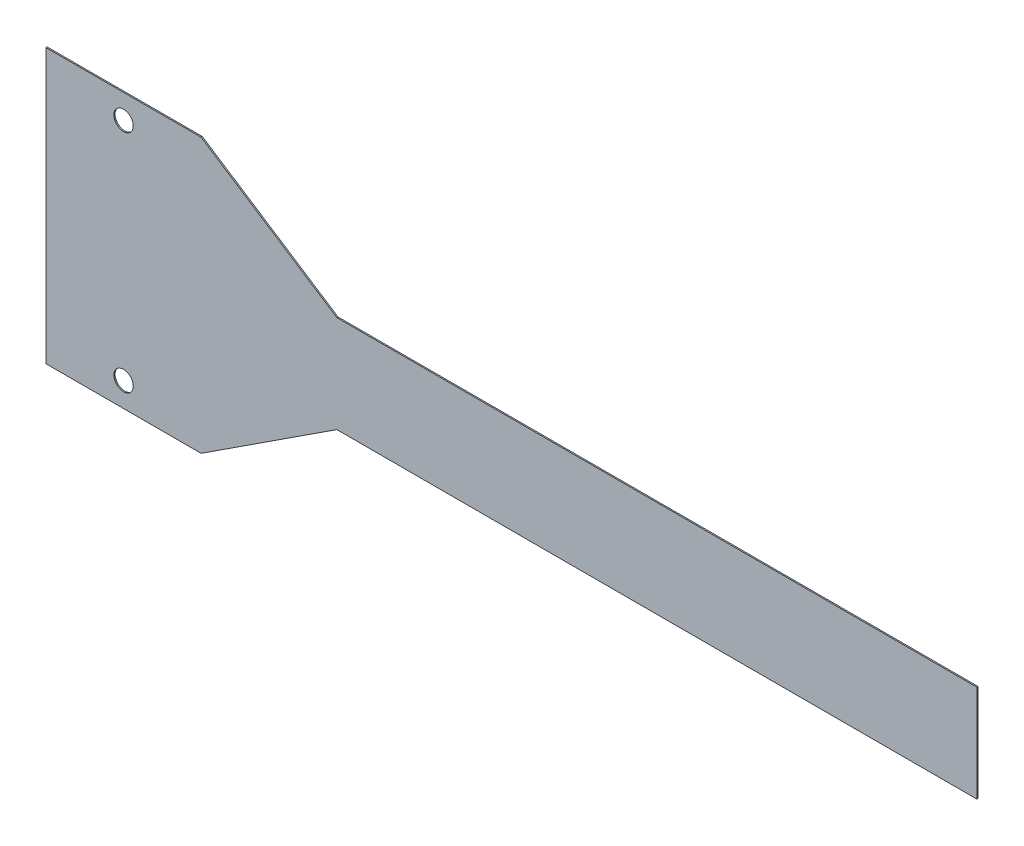
from build123d import *

# Parameters (mm, degrees)
SKETCH1_R             = 1
BOSS_EXTRUDE1_DEPTH   = 0.125
BOSS_EXTRUDE2_DEPTH   = 0.02
BOSS_EXTRUDE2_2_DEPTH = 0.02
BOSS_EXTRUDE2_3_DEPTH = 0.02


with BuildPart() as part:
    # Sketch1 → Boss-Extrude1 (new body)
    with BuildSketch(Plane.XY):
        Polygon((0, -9.12), (16, -9.12), (30, 0), (96, 0), (96, 10), (30, 10), (16, 19.12), (0, 19.12), align=None)
        with Locations((8, -6.62)):
            Circle(SKETCH1_R, mode=Mode.SUBTRACT)
        with Locations((8, 16.62)):
            Circle(SKETCH1_R, mode=Mode.SUBTRACT)
    extrude(amount=BOSS_EXTRUDE1_DEPTH)


with BuildPart() as body_2:
    # Sketch2 → Boss-Extrude2 (new body)
    with BuildSketch(Plane.XY):
        Polygon((5, -4.12), (5, -1.12), (11, -1.12), (11, -2.12), (30, 1.5), (86, 1.5), (86, 4.5), (86, 5.5), (87, 5.5), (93, 5.5), (93, 4.5), (87, 4.5), (87, 1.5), (87, 0.5), (86, 0.5), (30, 0.5), (11, -3.12), (11, -4.12), align=None)
    extrude(amount=-BOSS_EXTRUDE2_DEPTH)


with BuildPart() as body_3:
    # Sketch2 → Boss-Extrude2 2 (new body)
    with BuildSketch(Plane.XY):
        Polygon((5, 0.96), (5, 3.96), (11, 3.96), (11, 2.96), (30, 3.5), (68.5, 3.5), (68.5, 4.5), (68.5, 5.5), (69.5, 5.5), (75.5, 5.5), (75.5, 4.5), (69.5, 4.5), (69.5, 3.5), (69.5, 2.5), (68.5, 2.5), (30, 2.5), (11, 1.96), (11, 0.96), align=None)
    extrude(amount=-BOSS_EXTRUDE2_2_DEPTH)


with BuildPart() as body_4:
    # Sketch2 → Boss-Extrude2 3 (new body)
    with BuildSketch(Plane.XY):
        Polygon((94.5, 6.5), (93.5, 6.5), (30, 6.5), (11, 7.04), (11, 6.04), (5, 6.04), (5, 9.04), (11, 9.04), (11, 8.04), (30, 7.5), (93.5, 7.5), (93.5, 8.3), (30, 8.3), (11, 12.12), (11, 11.12), (5, 11.12), (5, 14.12), (11, 14.12), (11, 13.12), (30, 9.3), (93.5, 9.3), (94.5, 9.3), (94.5, 8.3), (94.5, 7.5), align=None)
    extrude(amount=-BOSS_EXTRUDE2_3_DEPTH)


solid = Compound([part.part, body_2.part, body_3.part, body_4.part])
